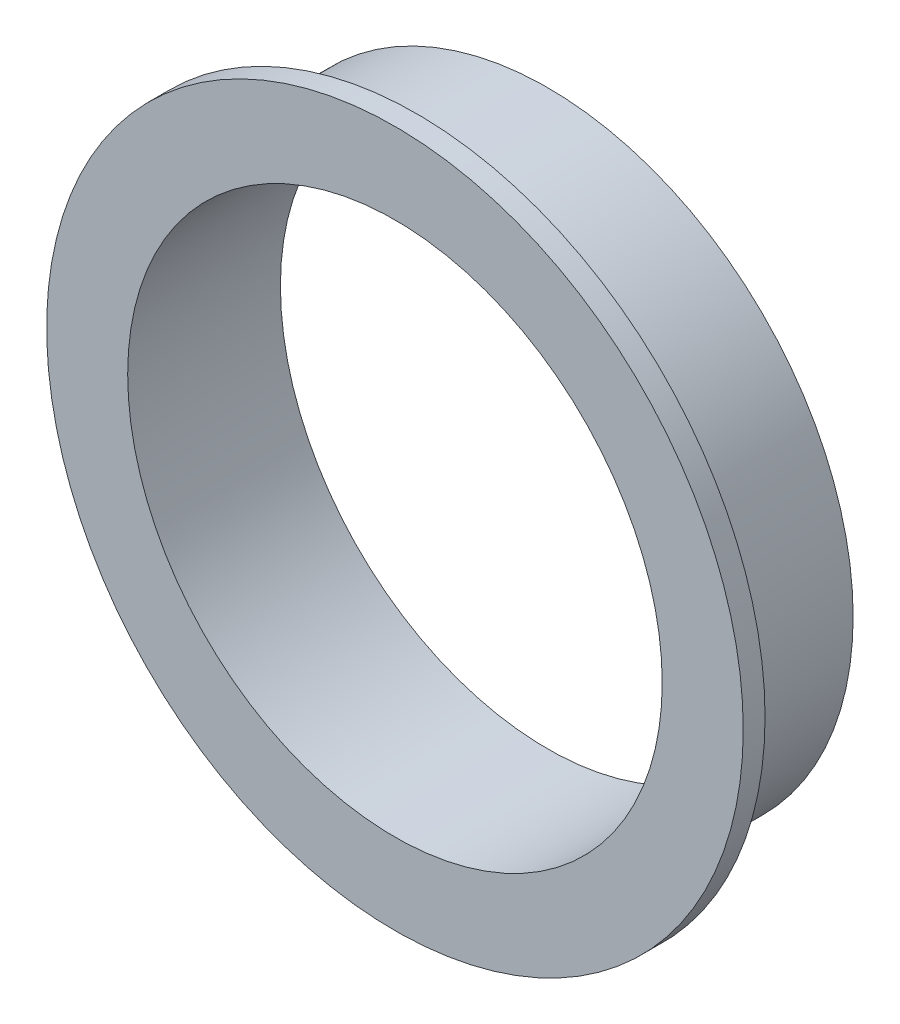
from build123d import *

# Parameters (mm, degrees)
SKETCH_1_R      = 14
SKETCH_1_R_2    = 12.25
EXTRUDE_1_DEPTH = 3
SKETCH_2_R      = 15.963029432
SKETCH_2_R_2    = 12.25
EXTRUDE_2_DEPTH = 1


with BuildPart() as part:
    # 草图1 → 凸台-拉伸1 (new, symmetric)
    with BuildSketch(Plane.XY):
        Circle(SKETCH_1_R)
        Circle(SKETCH_1_R_2, mode=Mode.SUBTRACT)
    extrude(amount=EXTRUDE_1_DEPTH, both=True)

    # 草图2 → 凸台-拉伸2 (add)
    with BuildSketch(Plane.XY.offset(3)):
        Circle(SKETCH_2_R)
        Circle(SKETCH_2_R_2, mode=Mode.SUBTRACT)
    extrude(amount=EXTRUDE_2_DEPTH)


solid = part.part
